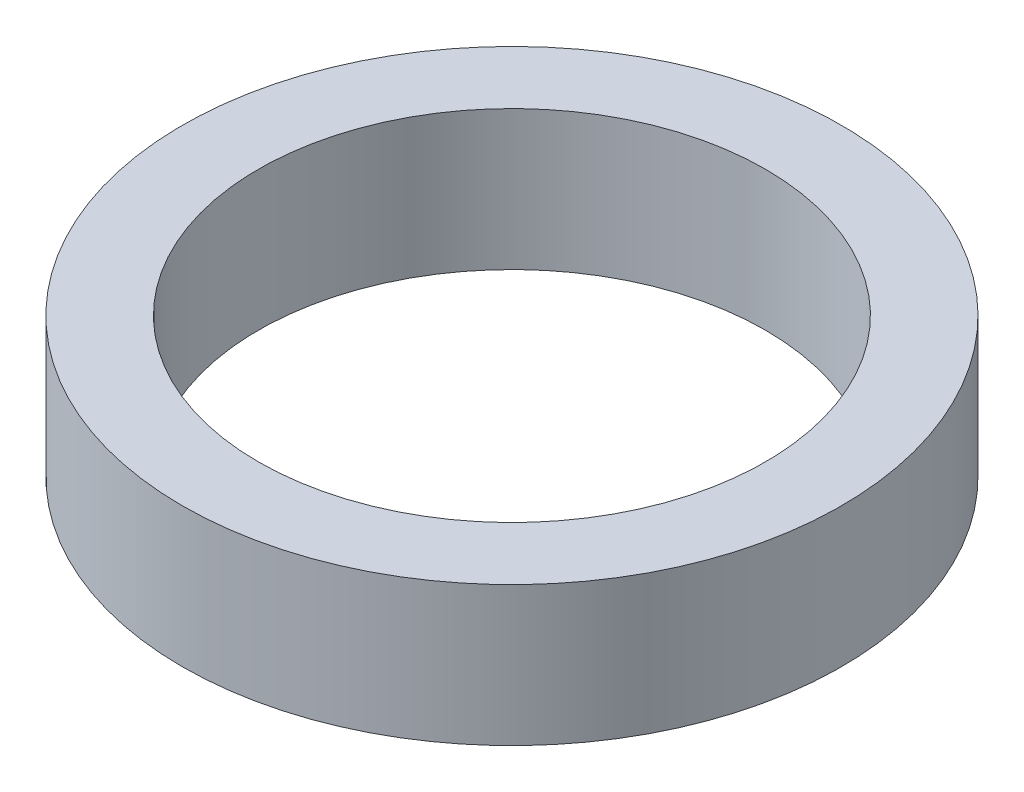
from build123d import *

# Parameters (mm, degrees)
SKETCH_1_R          = 13
EXTRUDE_1_DEPTH     = 5.5
SKETCH_2_R          = 10
CUT_EXTRUDE_1_DEPTH = 5.5


with BuildPart() as part:
    # 草图1 → 凸台-拉伸1 (new body)
    with BuildSketch(Plane(origin=(0, 0, 0), x_dir=(1, 0, 0), z_dir=(0, 1, 0))):
        with Locations(Location((0, 0, 0), (0, 0, 270))):
            Circle(SKETCH_1_R)
    extrude(amount=EXTRUDE_1_DEPTH)

    # 草图2 → 切除-拉伸1 (cut)
    with BuildSketch(Plane(origin=(0, 5.5, 0), x_dir=(1, 0, 0), z_dir=(0, 1, 0))):
        with Locations(Location((0, 0, 0), (0, 0, 270))):
            Circle(SKETCH_2_R)
    extrude(amount=-CUT_EXTRUDE_1_DEPTH, mode=Mode.SUBTRACT)


solid = part.part
